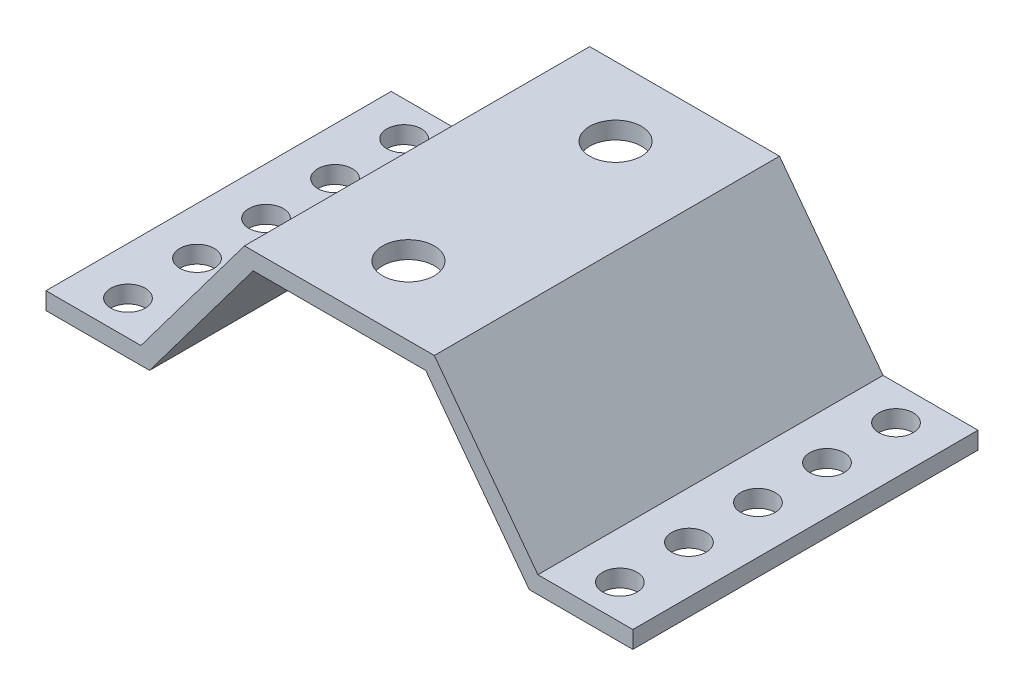
from build123d import *

# Parameters (mm, degrees)
BOSS_EXTRUDE1_DEPTH = 50
SKETCH2_R           = 5
CUT_EXTRUDE1_DEPTH  = 25
SKETCH3_R           = 7.5
CUT_EXTRUDE2_DEPTH  = 25


with BuildPart() as part:
    # Sketch1 → Boss-Extrude1 (new, symmetric)
    with BuildSketch(Plane.XY):
        Polygon((27.5, 45), (-27.5, 45), (-57.5, 5), (-85, 5), (-85, 0), (-55, 0), (-25, 40), (25, 40), (55, 0), (85, 0), (85, 5), (57.5, 5), align=None)
    extrude(amount=BOSS_EXTRUDE1_DEPTH, both=True)

    # Sketch2 → Cut-Extrude1 (cut, symmetric)
    with BuildSketch(Plane(origin=(0, 5, 0), x_dir=(1, 0, 0), z_dir=(0, 1, 0))):
        with Locations(Location((-71.25, -40, 0), (0, 0, 180))):
            Circle(SKETCH2_R)
        with Locations(Location((-71.25, -20, 0), (0, 0, 180))):
            Circle(SKETCH2_R)
        with Locations(Location((-71.25, 0, 0), (0, 0, 180))):
            Circle(SKETCH2_R)
        with Locations(Location((-71.25, 20, 0), (0, 0, 180))):
            Circle(SKETCH2_R)
        with Locations(Location((-71.25, 40, 0), (0, 0, 180))):
            Circle(SKETCH2_R)
    cut_extrude1 = extrude(amount=CUT_EXTRUDE1_DEPTH, both=True, mode=Mode.SUBTRACT)

    # Mirror1: Cut-Extrude1 across plane
    add(cut_extrude1.mirror(Plane(origin=(0, 0, 0), x_dir=(0, 0, 1), z_dir=(1, 0, 0))), mode=Mode.SUBTRACT)

    # Sketch3 → Cut-Extrude2 (cut, symmetric)
    with BuildSketch(Plane(origin=(0, 45, 0), x_dir=(1, 0, 0), z_dir=(0, 1, 0))):
        with Locations(Location((0, -30, 0), (0, 0, 270))):
            Circle(SKETCH3_R)
        with Locations(Location((0, 30, 0), (0, 0, 270))):
            Circle(SKETCH3_R)
    extrude(amount=CUT_EXTRUDE2_DEPTH, both=True, mode=Mode.SUBTRACT)


solid = part.part
